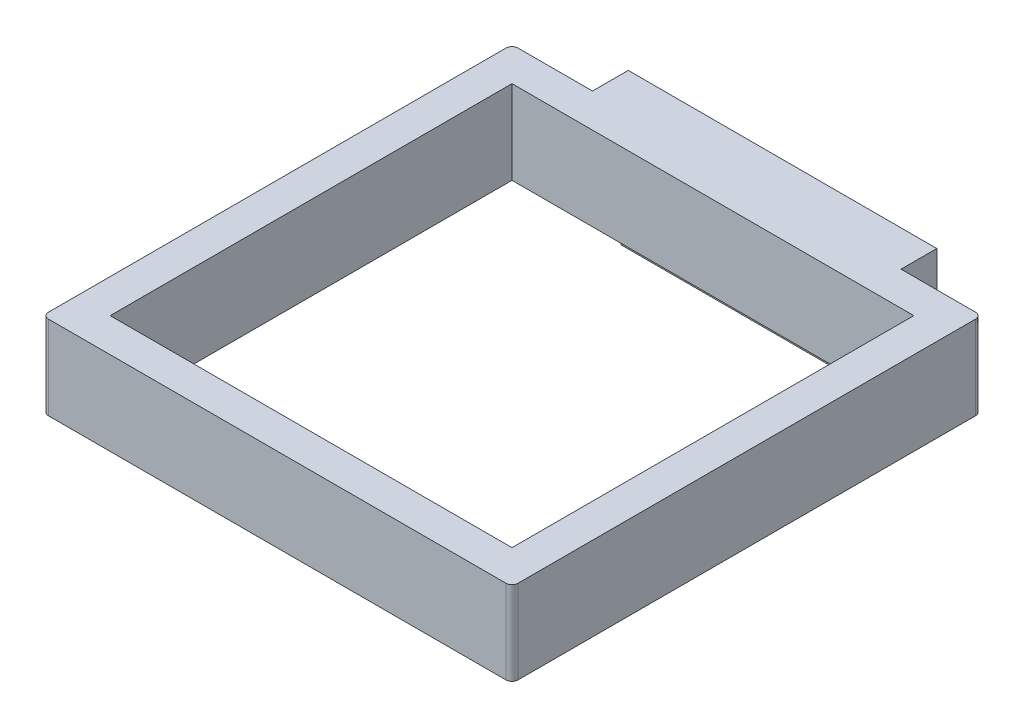
from build123d import *

# Parameters (mm, degrees)
SKETCH1_W           = 67.4
SKETCH1_H           = 67.4
BOSS_EXTRUDE1_DEPTH = 1.2
BOSS_EXTRUDE2_START = 12.85
SKETCH2_W           = 69.8
SKETCH2_H           = 69.8
SKETCH2_W_2         = 67.4
SKETCH2_H_2         = 67.4
BOSS_EXTRUDE2_DEPTH = 12.85
BOSS_EXTRUDE3_DEPTH = 10.7


with BuildPart() as part:
    # Sketch1 → Boss-Extrude1 (new body)
    with BuildSketch(Plane(origin=(0, 0, 0), x_dir=(1, 0, 0), z_dir=(0, 1, 0))):
        with BuildLine():
            Line((-22.840165497, 18.147363877), (-10.340165497, 18.147363877))
            Line((-10.340165497, 18.147363877), (-10.340165497, 24.147363877))
            Line((-10.340165497, 24.147363877), (41.409834503, 24.147363877))
            Line((41.409834503, 24.147363877), (41.409834503, 18.147363877))
            Line((41.409834503, 18.147363877), (53.909834503, 18.147363877))
            ThreePointArc((53.909834503, 18.147363877), (54.616941284, 17.854470658), (54.909834503, 17.147363877))
            Line((54.909834503, 17.147363877), (54.909834503, -59.602636123))
            ThreePointArc((54.909834503, -59.602636123), (54.616941284, -60.309742904), (53.909834503, -60.602636123))
            Line((53.909834503, -60.602636123), (-22.840165497, -60.602636123))
            ThreePointArc((-22.840165497, -60.602636123), (-23.547272279, -60.309742904), (-23.840165497, -59.602636123))
            Line((-23.840165497, -59.602636123), (-23.840165497, 17.147363877))
            ThreePointArc((-23.840165497, 17.147363877), (-23.547272279, 17.854470658), (-22.840165497, 18.147363877))
        make_face()
        with Locations((15.534834503, -21.227636123)):
            Rectangle(SKETCH1_W, SKETCH1_H, mode=Mode.SUBTRACT)
    extrude(amount=BOSS_EXTRUDE1_DEPTH)

    # Sketch2 → Boss-Extrude2 (add)
    # profile 1 of 2: a face of its own
    with BuildSketch(Plane.XZ.offset(BOSS_EXTRUDE2_START)):
        with BuildLine():
            Line((-10.340165497, -24.147363877), (41.409834503, -24.147363877))
            Line((41.409834503, -24.147363877), (41.409834503, -18.147363877))
            Line((41.409834503, -18.147363877), (53.909834503, -18.147363877))
            ThreePointArc((53.909834503, -18.147363877), (54.616941284, -17.854470658), (54.909834503, -17.147363877))
            Line((54.909834503, -17.147363877), (54.909834503, 59.602636123))
            ThreePointArc((54.909834503, 59.602636123), (54.616941284, 60.309742904), (53.909834503, 60.602636123))
            Line((53.909834503, 60.602636123), (-22.840165497, 60.602636123))
            ThreePointArc((-22.840165497, 60.602636123), (-23.547272279, 60.309742904), (-23.840165497, 59.602636123))
            Line((-23.840165497, 59.602636123), (-23.840165497, -17.147363877))
            ThreePointArc((-23.840165497, -17.147363877), (-23.547272279, -17.854470658), (-22.840165497, -18.147363877))
            Line((-22.840165497, -18.147363877), (-10.340165497, -18.147363877))
            Line((-10.340165497, -18.147363877), (-10.340165497, -24.147363877))
        make_face()
        Polygon((40.209834503, -16.947363877), (40.209834503, -22.947363877), (-9.140165497, -22.947363877), (-9.140165497, -16.947363877), (-22.640165497, -16.947363877), (-22.640165497, 59.402636123), (53.709834503, 59.402636123), (53.709834503, -16.947363877), align=None, mode=Mode.SUBTRACT)
    # profile 2 of 2: a face of its own
    with BuildSketch(Plane.XZ.offset(BOSS_EXTRUDE2_START)):
        with Locations((15.534834503, 21.227636123)):
            Rectangle(SKETCH2_W, SKETCH2_H)
        with Locations((15.534834503, 21.227636123)):
            Rectangle(SKETCH2_W_2, SKETCH2_H_2, mode=Mode.SUBTRACT)
    extrude(amount=-BOSS_EXTRUDE2_DEPTH)

    # Sketch3 → Boss-Extrude3 (add)
    with BuildSketch(Plane.XZ.offset(12.85)):
        Polygon((-9.140165497, -22.947363877), (-10.340165497, -22.947363877), (-10.340165497, -24.147363877), (41.409834503, -24.147363877), (41.409834503, -22.947363877), align=None)
    extrude(amount=BOSS_EXTRUDE3_DEPTH)


solid = part.part
